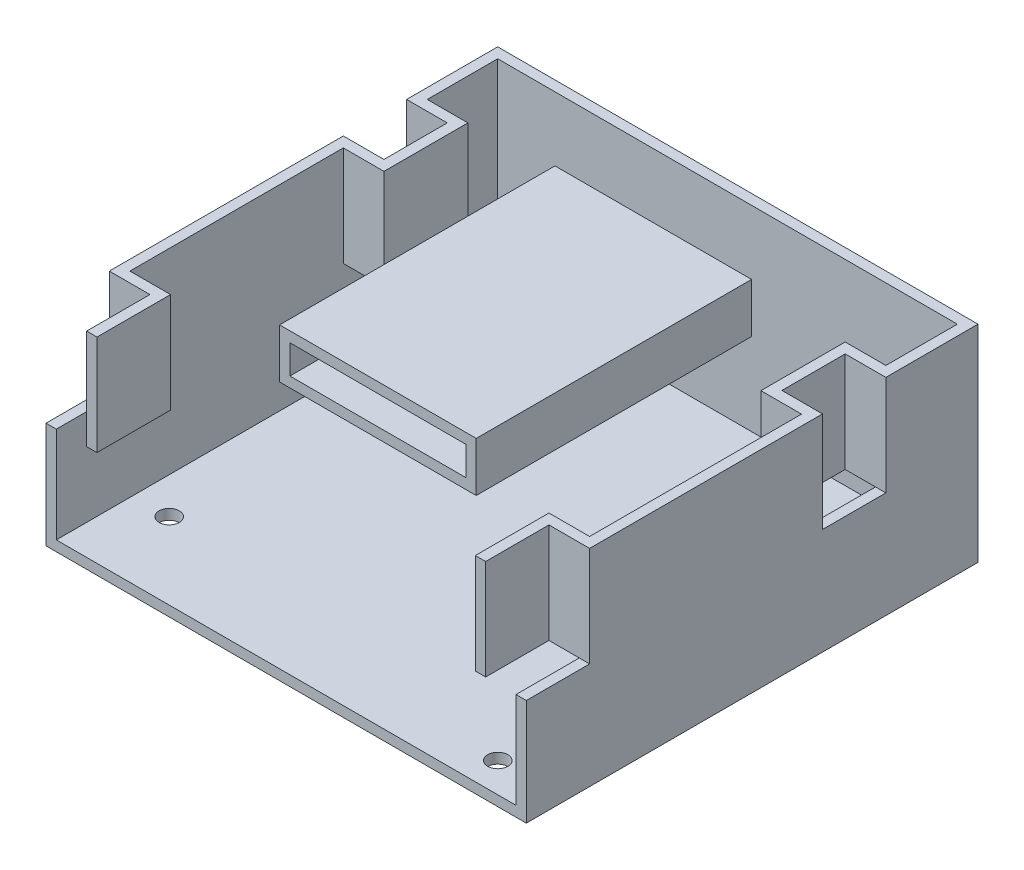
from build123d import *

# Parameters (mm, degrees)
SKETCH1_W            = 89.12
SKETCH1_H            = 85.57
BOSS_EXTRUDE1_DEPTH  = 2
SKETCH3_W            = 2
SKETCH3_H            = 30
BOSS_EXTRUDE2_DEPTH  = 85.57
SKETCH4_W            = 2
SKETCH4_H            = 30
BOSS_EXTRUDE3_DEPTH  = 85.57
SKETCH5_W            = 93.12
SKETCH5_H            = 2
BOSS_EXTRUDE4_DEPTH  = 30
SKETCH6_R            = 1.96
CUT_EXTRUDE2_DEPTH   = 30
SKETCH7_R            = 1.96
CUT_EXTRUDE3_DEPTH   = 30
SKETCH8_R            = 1.96
CUT_EXTRUDE4_DEPTH   = 30
SKETCH9_R            = 1.96
CUT_EXTRUDE5_DEPTH   = 30
SKETCH11_W           = 2
SKETCH11_H           = 12.27
BOSS_EXTRUDE5_DEPTH  = 9.4
SKETCH12_W           = 2
SKETCH12_H           = 12.27
CUT_EXTRUDE6_DEPTH   = 9.4
SKETCH13_W           = 2
SKETCH13_H           = 12.27
BOSS_EXTRUDE6_DEPTH  = 9.4
SKETCH14_W           = 2
SKETCH14_H           = 12.27
CUT_EXTRUDE7_DEPTH   = 9.4
SKETCH15_W           = 2
SKETCH15_H           = 12.27
BOSS_EXTRUDE7_DEPTH  = 9.4
SKETCH16_W           = 2
SKETCH16_H           = 12.27
CUT_EXTRUDE8_DEPTH   = 9.4
SKETCH17_W           = 2
SKETCH17_H           = 12.27
BOSS_EXTRUDE8_DEPTH  = 9.4
SKETCH18_W           = 2
SKETCH18_H           = 12.27
CUT_EXTRUDE9_DEPTH   = 9.4
BOSS_EXTRUDE9_DEPTH  = 10
SKETCH20_W           = 16
SKETCH20_H           = 42.55
BOSS_EXTRUDE10_DEPTH = 8.88
SKETCH21_W           = 16
SKETCH21_H           = 6.88
CUT_EXTRUDE10_DEPTH  = 42.55
SKETCH22_W           = 38.12
SKETCH22_H           = 9.59
BOSS_EXTRUDE11_DEPTH = 53.38
SKETCH23_W           = 34.12
SKETCH23_H           = 5.59
CUT_EXTRUDE11_DEPTH  = 53.38


with BuildPart() as part:
    # Sketch1 → Boss-Extrude1 (new body)
    with BuildSketch(Plane(origin=(0, 0, 0), x_dir=(1, 0, 0), z_dir=(0, 1, 0))):
        with Locations((44.56, 42.785)):
            Rectangle(SKETCH1_W, SKETCH1_H)
    extrude(amount=BOSS_EXTRUDE1_DEPTH)

    # Sketch3 → Boss-Extrude2 (add)
    with BuildSketch(Plane.XY):
        with Locations((-1, 15)):
            Rectangle(SKETCH3_W, SKETCH3_H)
    extrude(amount=-BOSS_EXTRUDE2_DEPTH)

    # Sketch4 → Boss-Extrude3 (add)
    with BuildSketch(Plane.XY):
        with Locations((90.12, 15)):
            Rectangle(SKETCH4_W, SKETCH4_H)
    extrude(amount=-BOSS_EXTRUDE3_DEPTH)

    # Sketch5 → Boss-Extrude4 (add)
    with BuildSketch(Plane(origin=(0, 0, 0), x_dir=(1, 0, 0), z_dir=(0, 1, 0))):
        with Locations((44.56, 86.57)):
            Rectangle(SKETCH5_W, SKETCH5_H)
    extrude(amount=BOSS_EXTRUDE4_DEPTH)

    # Sketch6 → Cut-Extrude2 (cut)
    with BuildSketch(Plane(origin=(0, 0, 0), x_dir=(1, 0, 0), z_dir=(0, 1, 0))):
        with Locations(Location((79.835, 5.755, 0), (0, 0, 90))):
            Circle(SKETCH6_R)
    extrude(amount=CUT_EXTRUDE2_DEPTH, mode=Mode.SUBTRACT)

    # Sketch7 → Cut-Extrude3 (cut)
    with BuildSketch(Plane(origin=(0, 2, 0), x_dir=(1, 0, 0), z_dir=(0, 1, 0))):
        with Locations(Location((82.285, 76.225, 0), (0, 0, 270))):
            Circle(SKETCH7_R)
    extrude(amount=-CUT_EXTRUDE3_DEPTH, mode=Mode.SUBTRACT)

    # Sketch8 → Cut-Extrude4 (cut)
    with BuildSketch(Plane(origin=(0, 0, 0), x_dir=(1, 0, 0), z_dir=(0, 1, 0))):
        with Locations(Location((6.985, 78.28, 0), (0, 0, 90))):
            Circle(SKETCH8_R)
    extrude(amount=CUT_EXTRUDE4_DEPTH, mode=Mode.SUBTRACT)

    # Sketch9 → Cut-Extrude5 (cut)
    with BuildSketch(Plane(origin=(0, 2, 0), x_dir=(1, 0, 0), z_dir=(0, 1, 0))):
        with Locations(Location((7.035, 14.85, 0), (0, 0, 270))):
            Circle(SKETCH9_R)
    extrude(amount=-CUT_EXTRUDE5_DEPTH, mode=Mode.SUBTRACT)

    # Sketch11 → Boss-Extrude5 (add)
    with BuildSketch(Plane(origin=(0, 30, 0), x_dir=(1, 0, 0), z_dir=(0, 1, 0))):
        Polygon((83.24, 12.27), (89.12, 12.27), (89.12, 14.27), (81.24, 14.27), (81.24, 12.27), align=None)
        with Locations((82.24, 6.135)):
            Rectangle(SKETCH11_W, SKETCH11_H)
    extrude(amount=-BOSS_EXTRUDE5_DEPTH)

    # Sketch12 → Cut-Extrude6 (cut)
    with BuildSketch(Plane(origin=(0, 30, 0), x_dir=(1, 0, 0), z_dir=(0, 1, 0))):
        with Locations((90.12, 6.135)):
            Rectangle(SKETCH12_W, SKETCH12_H)
    extrude(amount=-CUT_EXTRUDE6_DEPTH, mode=Mode.SUBTRACT)

    # Sketch13 → Boss-Extrude6 (add)
    with BuildSketch(Plane(origin=(0, 30, 0), x_dir=(1, 0, 0), z_dir=(0, 1, 0))):
        Polygon((83.24, 69.7), (89.12, 69.7), (89.12, 71.7), (81.24, 71.7), (81.24, 69.7), align=None)
        with Locations((82.24, 63.565)):
            Rectangle(SKETCH13_W, SKETCH13_H)
        Polygon((89.12, 55.359786784), (89.12, 57.43), (83.24, 57.43), (81.24, 57.43), (81.24, 55.359786784), align=None)
    extrude(amount=-BOSS_EXTRUDE6_DEPTH)

    # Sketch14 → Cut-Extrude7 (cut)
    with BuildSketch(Plane(origin=(0, 30, 0), x_dir=(1, 0, 0), z_dir=(0, 1, 0))):
        with Locations((90.12, 63.565)):
            Rectangle(SKETCH14_W, SKETCH14_H)
    extrude(amount=-CUT_EXTRUDE7_DEPTH, mode=Mode.SUBTRACT)

    # Sketch15 → Boss-Extrude7 (add)
    with BuildSketch(Plane(origin=(0, 30, 0), x_dir=(1, 0, 0), z_dir=(0, 1, 0))):
        Polygon((0, 71.91), (0, 69.91), (5.88, 69.91), (7.88, 69.91), (7.88, 71.91), align=None)
        with Locations((6.88, 63.775)):
            Rectangle(SKETCH15_W, SKETCH15_H)
        Polygon((5.88, 57.64), (0, 57.64), (0, 55.64), (7.88, 55.64), (7.88, 57.64), align=None)
    extrude(amount=-BOSS_EXTRUDE7_DEPTH)

    # Sketch16 → Cut-Extrude8 (cut)
    with BuildSketch(Plane(origin=(0, 30, 0), x_dir=(1, 0, 0), z_dir=(0, 1, 0))):
        with Locations((-1, 63.775)):
            Rectangle(SKETCH16_W, SKETCH16_H)
    extrude(amount=-CUT_EXTRUDE8_DEPTH, mode=Mode.SUBTRACT)

    # Sketch17 → Boss-Extrude8 (add)
    with BuildSketch(Plane(origin=(0, 30, 0), x_dir=(1, 0, 0), z_dir=(0, 1, 0))):
        Polygon((0, 14.27), (0, 12.27), (5.88, 12.27), (7.88, 12.27), (7.88, 14.27), align=None)
        with Locations((6.88, 6.135)):
            Rectangle(SKETCH17_W, SKETCH17_H)
    extrude(amount=-BOSS_EXTRUDE8_DEPTH)

    # Sketch18 → Cut-Extrude9 (cut)
    with BuildSketch(Plane(origin=(0, 30, 0), x_dir=(1, 0, 0), z_dir=(0, 1, 0))):
        with Locations((-1, 6.135)):
            Rectangle(SKETCH18_W, SKETCH18_H)
    extrude(amount=-CUT_EXTRUDE9_DEPTH, mode=Mode.SUBTRACT)

    # Sketch19 → Boss-Extrude9 (add)
    with BuildSketch(Plane(origin=(0, 30, 0), x_dir=(1, 0, 0), z_dir=(0, 1, 0))):
        Polygon((83.24, 0), (81.24, 0), (81.24, 14.27), (89.12, 14.27), (89.12, 55.359786784), (81.24, 55.359786784), (81.24, 71.7), (89.12, 71.7), (89.12, 85.57), (0, 85.57), (0, 71.91), (7.88, 71.91), (7.88, 55.64), (0, 55.64), (0, 14.27), (7.88, 14.27), (7.88, 0), (5.88, 0), (5.88, 12.27), (-2, 12.27), (-2, 57.64), (5.88, 57.64), (5.88, 69.91), (-2, 69.91), (-2, 87.57), (91.12, 87.57), (91.12, 69.7), (83.24, 69.7), (83.24, 57.43), (91.12, 57.43), (91.12, 12.27), (83.24, 12.27), align=None)
    extrude(amount=BOSS_EXTRUDE9_DEPTH)

    # Sketch20 → Boss-Extrude10 (add)
    with BuildSketch(Plane(origin=(0, 2, 0), x_dir=(1, 0, 0), z_dir=(0, 1, 0))):
        with Locations((19.1, 64.295)):
            Rectangle(SKETCH20_W, SKETCH20_H)
    extrude(amount=BOSS_EXTRUDE10_DEPTH)

    # Sketch21 → Cut-Extrude10 (cut)
    with BuildSketch(Plane.XY.offset(-43.02)):
        with Locations((19.1, 5.44)):
            Rectangle(SKETCH21_W, SKETCH21_H)
    extrude(amount=-CUT_EXTRUDE10_DEPTH, mode=Mode.SUBTRACT)

    # Sketch22 → Boss-Extrude11 (add)
    with BuildSketch(Plane.XY.offset(-85.57)):
        with Locations((30.16, 22.763941004)):
            Rectangle(SKETCH22_W, SKETCH22_H)
    extrude(amount=BOSS_EXTRUDE11_DEPTH)

    # Sketch23 → Cut-Extrude11 (cut)
    with BuildSketch(Plane.XY.offset(-32.19)):
        with Locations((30.16, 22.763941004)):
            Rectangle(SKETCH23_W, SKETCH23_H)
    extrude(amount=-CUT_EXTRUDE11_DEPTH, mode=Mode.SUBTRACT)


solid = part.part
